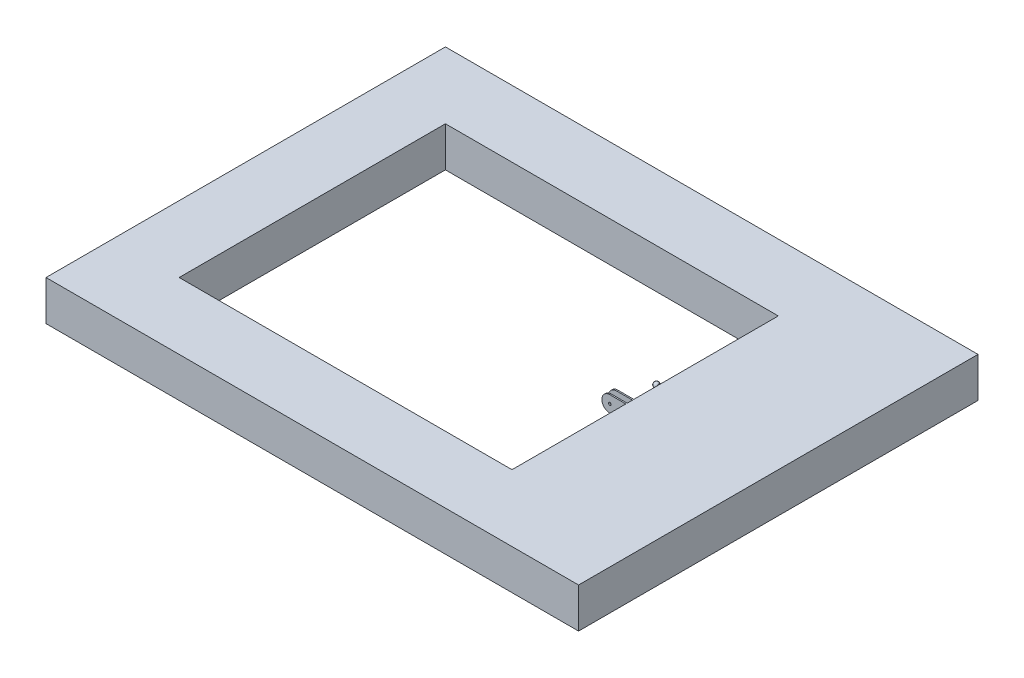
from build123d import *

# Parameters (mm, degrees)
SKETCH1_W           = 4000
SKETCH1_H           = 300
BOSS_EXTRUDE1_DEPTH = 3000
SKETCH3_W           = 2500
SKETCH3_H           = 2000
CUT_EXTRUDE1_DEPTH  = 3000
SKETCH6_R           = 10
BOSS_EXTRUDE2_DEPTH = 10
SKETCH7_R           = 10
BOSS_EXTRUDE3_DEPTH = 10


with BuildPart() as part:
    # Sketch1 → Boss-Extrude1 (new body)
    with BuildSketch(Plane.XY):
        with Locations((2000, 150)):
            Rectangle(SKETCH1_W, SKETCH1_H)
    extrude(amount=BOSS_EXTRUDE1_DEPTH)

    # Sketch3 → Cut-Extrude1 (cut)
    with BuildSketch(Plane(origin=(0, 300, 0), x_dir=(1, 0, 0), z_dir=(0, 1, 0))):
        with Locations((1750, -1500)):
            Rectangle(SKETCH3_W, SKETCH3_H)
    extrude(amount=-CUT_EXTRUDE1_DEPTH, mode=Mode.SUBTRACT)

    # Sketch6 → Boss-Extrude2 (add)
    with BuildSketch(Plane(origin=(0, 0, 1645), x_dir=(-1, 0, 0), z_dir=(0, 0, -1))):
        with BuildLine():
            Line((-3000, 300), (-3000, 180))
            Line((-3000, 180), (-2880, 180))
            ThreePointArc((-2880, 180), (-2820, 240), (-2880, 300))
            Line((-2880, 300), (-3000, 300))
        make_face()
        with Locations((-2880, 240)):
            Circle(SKETCH6_R, mode=Mode.SUBTRACT)
    extrude(amount=BOSS_EXTRUDE2_DEPTH)

    # Sketch7 → Boss-Extrude3 (add)
    with BuildSketch(Plane(origin=(0, 0, 1595), x_dir=(-1, 0, 0), z_dir=(0, 0, -1))):
        with BuildLine():
            Line((-3000, 300), (-3000, 180))
            Line((-3000, 180), (-2880, 180))
            ThreePointArc((-2880, 180), (-2820, 240), (-2880, 300))
            Line((-2880, 300), (-3000, 300))
        make_face()
        with Locations((-2880, 240)):
            Circle(SKETCH7_R, mode=Mode.SUBTRACT)
    extrude(amount=BOSS_EXTRUDE3_DEPTH)

    # Sketch8 → Revolve1 (revolve)
    with BuildSketch(Plane(origin=(0, 0, 1385), x_dir=(-1, 0, 0), z_dir=(0, 0, -1)), mode=Mode.PRIVATE) as revolve1_sk:
        with BuildLine():
            Line((-3000, 300), (-3000, 280))
            Line((-3000, 280), (-2950, 280))
            ThreePointArc((-2950, 280), (-2963.709750078, 298.985066655), (-2986.043275591, 291.942081406))
            Line((-2986.043275591, 291.942081406), (-3000, 300))
        make_face()
    revolve(revolve1_sk.sketch.rotate(Axis((3000, 280, 1385), (-1, 0, 0)), 90), axis=Axis((3000, 280, 1385), (-1, 0, 0)))


solid = part.part
